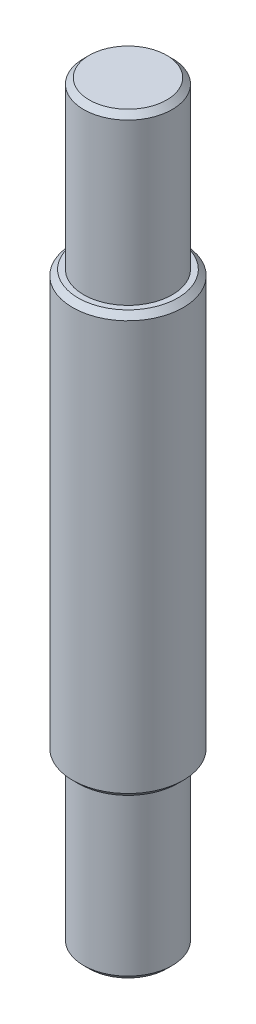
from build123d import *

# Parameters (mm, degrees)
SKETCH1_R           = 5
BOSS_EXTRUDE1_DEPTH = 19
SKETCH2_R           = 4
BOSS_EXTRUDE2_DEPTH = 15
BOSS_EXTRUDE3_START = -53
SKETCH2_2_R         = 4
BOSS_EXTRUDE3_DEPTH = 15
CHAMFER1_SIZE       = 0.5
CHAMFER2_SIZE       = 0.5


with BuildPart() as part:
    # Sketch1 → Boss-Extrude1 (new, symmetric)
    with BuildSketch(Plane(origin=(0, 0, 0), x_dir=(1, 0, 0), z_dir=(0, 1, 0))):
        with Locations(Location((0, 0, 0), (0, 0, 270))):
            Circle(SKETCH1_R)
    extrude(amount=BOSS_EXTRUDE1_DEPTH, both=True)

    # Sketch2 → Boss-Extrude2 (add)
    with BuildSketch(Plane(origin=(0, 19, 0), x_dir=(1, 0, 0), z_dir=(0, 1, 0))):
        with Locations(Location((0, 0, 0), (0, 0, 270))):
            Circle(SKETCH2_R)
    extrude(amount=BOSS_EXTRUDE2_DEPTH)

    # Sketch2<2> → Boss-Extrude3 (add)
    with BuildSketch(Plane(origin=(0, 19, 0), x_dir=(1, 0, 0), z_dir=(0, 1, 0)).offset(BOSS_EXTRUDE3_START)):
        with Locations(Location((0, 0, 0), (0, 0, 270))):
            Circle(SKETCH2_2_R)
    extrude(amount=BOSS_EXTRUDE3_DEPTH)

    # Chamfer1
    chamfer1_edges = [part.edges().sort_by_distance(p)[0] for p in [
        (0, -34, -4),
        (0, 34, -4),
    ]]
    chamfer(chamfer1_edges, length=CHAMFER1_SIZE)

    # Chamfer2
    chamfer2_edges = [part.edges().sort_by_distance(p)[0] for p in [
        (0, -19, -5),
        (0, 19, -5),
    ]]
    chamfer(chamfer2_edges, length=CHAMFER2_SIZE)


solid = part.part
